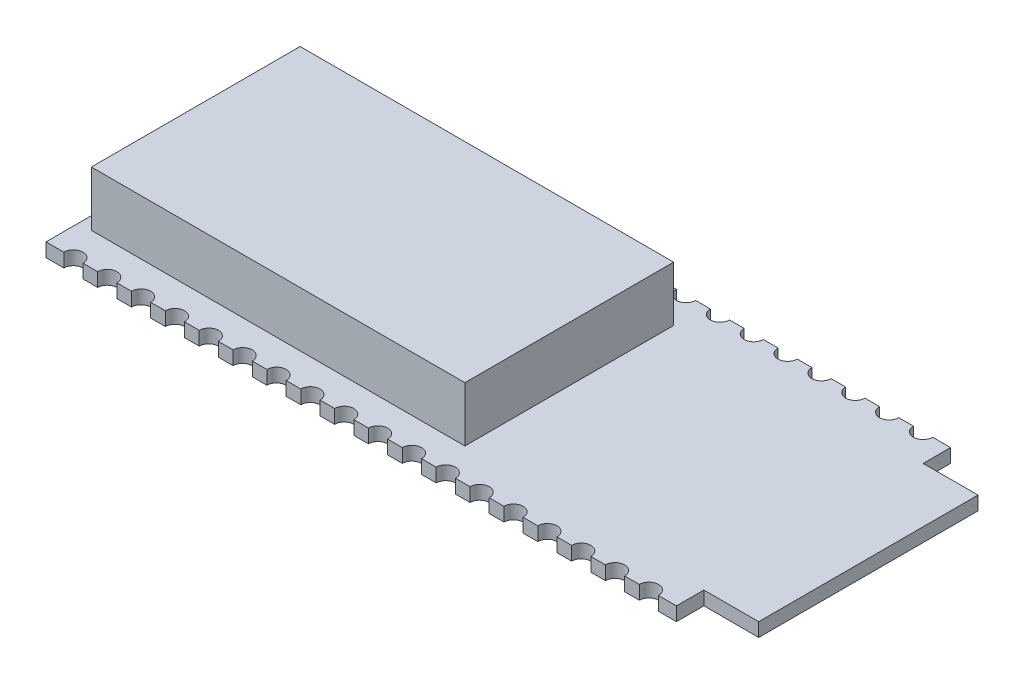
from build123d import *

# Parameters (mm, degrees)
BOSS_EXTRUDE2_DEPTH      = 1
SKETCH5_R                = 0.7
CUT_EXTRUDE2_DEPTH       = 1
LPATTERN2_COUNT          = 18
LPATTERN2_PITCH          = 2.47
MIRROR1_COPY_1_SKETCH_R  = 0.7
MIRROR1_COPY_1_DEPTH     = 1
MIRROR1_COPY_2_SKETCH_R  = 0.7
MIRROR1_COPY_2_DEPTH     = 1
MIRROR1_COPY_3_SKETCH_R  = 0.7
MIRROR1_COPY_3_DEPTH     = 1
MIRROR1_COPY_4_SKETCH_R  = 0.7
MIRROR1_COPY_4_DEPTH     = 1
MIRROR1_COPY_5_SKETCH_R  = 0.7
MIRROR1_COPY_5_DEPTH     = 1
MIRROR1_COPY_6_SKETCH_R  = 0.7
MIRROR1_COPY_6_DEPTH     = 1
MIRROR1_COPY_7_SKETCH_R  = 0.7
MIRROR1_COPY_7_DEPTH     = 1
MIRROR1_COPY_8_SKETCH_R  = 0.7
MIRROR1_COPY_8_DEPTH     = 1
MIRROR1_COPY_9_SKETCH_R  = 0.7
MIRROR1_COPY_9_DEPTH     = 1
MIRROR1_COPY_10_SKETCH_R = 0.7
MIRROR1_COPY_10_DEPTH    = 1
MIRROR1_COPY_11_SKETCH_R = 0.7
MIRROR1_COPY_11_DEPTH    = 1
MIRROR1_COPY_12_SKETCH_R = 0.7
MIRROR1_COPY_12_DEPTH    = 1
MIRROR1_COPY_13_SKETCH_R = 0.7
MIRROR1_COPY_13_DEPTH    = 1
MIRROR1_COPY_14_SKETCH_R = 0.7
MIRROR1_COPY_14_DEPTH    = 1
MIRROR1_COPY_15_SKETCH_R = 0.7
MIRROR1_COPY_15_DEPTH    = 1
MIRROR1_COPY_16_SKETCH_R = 0.7
MIRROR1_COPY_16_DEPTH    = 1
MIRROR1_COPY_17_SKETCH_R = 0.7
MIRROR1_COPY_17_DEPTH    = 1
SKETCH6_W                = 27.254379167
SKETCH6_H                = 15.23216969
BOSS_EXTRUDE3_DEPTH      = 4


with BuildPart() as part:
    # Sketch4 → Boss-Extrude2 (new body)
    with BuildSketch(Plane(origin=(0, 0, 0), x_dir=(1, 0, 0), z_dir=(0, 1, 0))):
        Polygon((-23, -10), (23, -10), (23, -8), (27, -8), (27, 8), (23, 8), (23, 10), (-23, 10), align=None)
    extrude(amount=BOSS_EXTRUDE2_DEPTH)

    # Sketch5 → Cut-Extrude2 (cut)
    with BuildSketch(Plane(origin=(0, 1, 0), x_dir=(1, 0, 0), z_dir=(0, 1, 0))):
        with Locations((-21, 10)):
            Circle(SKETCH5_R)
    cut_extrude2 = extrude(amount=-CUT_EXTRUDE2_DEPTH, mode=Mode.SUBTRACT)

    # LPattern2: Cut-Extrude2 ×18
    with Locations(*[(i * LPATTERN2_PITCH, 0, 0) for i in range(1, LPATTERN2_COUNT)]):
        add(cut_extrude2, mode=Mode.SUBTRACT)

    # Mirror1: Cut-Extrude2 across plane
    add(cut_extrude2.mirror(Plane.XY), mode=Mode.SUBTRACT)

    # Mirror1 copy 1 sketch → Mirror1 copy 1 (cut)
    with BuildSketch(Plane(origin=(2.47, 1, 0), x_dir=(1, 0, 0), z_dir=(0, 1, 0))):
        with Locations((-21, -10)):
            Circle(MIRROR1_COPY_1_SKETCH_R)
    extrude(amount=-MIRROR1_COPY_1_DEPTH, mode=Mode.SUBTRACT)

    # Mirror1 copy 2 sketch → Mirror1 copy 2 (cut)
    with BuildSketch(Plane(origin=(4.94, 1, 0), x_dir=(1, 0, 0), z_dir=(0, 1, 0))):
        with Locations((-21, -10)):
            Circle(MIRROR1_COPY_2_SKETCH_R)
    extrude(amount=-MIRROR1_COPY_2_DEPTH, mode=Mode.SUBTRACT)

    # Mirror1 copy 3 sketch → Mirror1 copy 3 (cut)
    with BuildSketch(Plane(origin=(7.41, 1, 0), x_dir=(1, 0, 0), z_dir=(0, 1, 0))):
        with Locations((-21, -10)):
            Circle(MIRROR1_COPY_3_SKETCH_R)
    extrude(amount=-MIRROR1_COPY_3_DEPTH, mode=Mode.SUBTRACT)

    # Mirror1 copy 4 sketch → Mirror1 copy 4 (cut)
    with BuildSketch(Plane(origin=(9.88, 1, 0), x_dir=(1, 0, 0), z_dir=(0, 1, 0))):
        with Locations((-21, -10)):
            Circle(MIRROR1_COPY_4_SKETCH_R)
    extrude(amount=-MIRROR1_COPY_4_DEPTH, mode=Mode.SUBTRACT)

    # Mirror1 copy 5 sketch → Mirror1 copy 5 (cut)
    with BuildSketch(Plane(origin=(12.35, 1, 0), x_dir=(1, 0, 0), z_dir=(0, 1, 0))):
        with Locations((-21, -10)):
            Circle(MIRROR1_COPY_5_SKETCH_R)
    extrude(amount=-MIRROR1_COPY_5_DEPTH, mode=Mode.SUBTRACT)

    # Mirror1 copy 6 sketch → Mirror1 copy 6 (cut)
    with BuildSketch(Plane(origin=(14.82, 1, 0), x_dir=(1, 0, 0), z_dir=(0, 1, 0))):
        with Locations((-21, -10)):
            Circle(MIRROR1_COPY_6_SKETCH_R)
    extrude(amount=-MIRROR1_COPY_6_DEPTH, mode=Mode.SUBTRACT)

    # Mirror1 copy 7 sketch → Mirror1 copy 7 (cut)
    with BuildSketch(Plane(origin=(17.29, 1, 0), x_dir=(1, 0, 0), z_dir=(0, 1, 0))):
        with Locations((-21, -10)):
            Circle(MIRROR1_COPY_7_SKETCH_R)
    extrude(amount=-MIRROR1_COPY_7_DEPTH, mode=Mode.SUBTRACT)

    # Mirror1 copy 8 sketch → Mirror1 copy 8 (cut)
    with BuildSketch(Plane(origin=(19.76, 1, 0), x_dir=(1, 0, 0), z_dir=(0, 1, 0))):
        with Locations((-21, -10)):
            Circle(MIRROR1_COPY_8_SKETCH_R)
    extrude(amount=-MIRROR1_COPY_8_DEPTH, mode=Mode.SUBTRACT)

    # Mirror1 copy 9 sketch → Mirror1 copy 9 (cut)
    with BuildSketch(Plane(origin=(22.23, 1, 0), x_dir=(1, 0, 0), z_dir=(0, 1, 0))):
        with Locations((-21, -10)):
            Circle(MIRROR1_COPY_9_SKETCH_R)
    extrude(amount=-MIRROR1_COPY_9_DEPTH, mode=Mode.SUBTRACT)

    # Mirror1 copy 10 sketch → Mirror1 copy 10 (cut)
    with BuildSketch(Plane(origin=(24.7, 1, 0), x_dir=(1, 0, 0), z_dir=(0, 1, 0))):
        with Locations((-21, -10)):
            Circle(MIRROR1_COPY_10_SKETCH_R)
    extrude(amount=-MIRROR1_COPY_10_DEPTH, mode=Mode.SUBTRACT)

    # Mirror1 copy 11 sketch → Mirror1 copy 11 (cut)
    with BuildSketch(Plane(origin=(27.17, 1, 0), x_dir=(1, 0, 0), z_dir=(0, 1, 0))):
        with Locations((-21, -10)):
            Circle(MIRROR1_COPY_11_SKETCH_R)
    extrude(amount=-MIRROR1_COPY_11_DEPTH, mode=Mode.SUBTRACT)

    # Mirror1 copy 12 sketch → Mirror1 copy 12 (cut)
    with BuildSketch(Plane(origin=(29.64, 1, 0), x_dir=(1, 0, 0), z_dir=(0, 1, 0))):
        with Locations((-21, -10)):
            Circle(MIRROR1_COPY_12_SKETCH_R)
    extrude(amount=-MIRROR1_COPY_12_DEPTH, mode=Mode.SUBTRACT)

    # Mirror1 copy 13 sketch → Mirror1 copy 13 (cut)
    with BuildSketch(Plane(origin=(32.11, 1, 0), x_dir=(1, 0, 0), z_dir=(0, 1, 0))):
        with Locations((-21, -10)):
            Circle(MIRROR1_COPY_13_SKETCH_R)
    extrude(amount=-MIRROR1_COPY_13_DEPTH, mode=Mode.SUBTRACT)

    # Mirror1 copy 14 sketch → Mirror1 copy 14 (cut)
    with BuildSketch(Plane(origin=(34.58, 1, 0), x_dir=(1, 0, 0), z_dir=(0, 1, 0))):
        with Locations((-21, -10)):
            Circle(MIRROR1_COPY_14_SKETCH_R)
    extrude(amount=-MIRROR1_COPY_14_DEPTH, mode=Mode.SUBTRACT)

    # Mirror1 copy 15 sketch → Mirror1 copy 15 (cut)
    with BuildSketch(Plane(origin=(37.05, 1, 0), x_dir=(1, 0, 0), z_dir=(0, 1, 0))):
        with Locations((-21, -10)):
            Circle(MIRROR1_COPY_15_SKETCH_R)
    extrude(amount=-MIRROR1_COPY_15_DEPTH, mode=Mode.SUBTRACT)

    # Mirror1 copy 16 sketch → Mirror1 copy 16 (cut)
    with BuildSketch(Plane(origin=(39.52, 1, 0), x_dir=(1, 0, 0), z_dir=(0, 1, 0))):
        with Locations((-21, -10)):
            Circle(MIRROR1_COPY_16_SKETCH_R)
    extrude(amount=-MIRROR1_COPY_16_DEPTH, mode=Mode.SUBTRACT)

    # Mirror1 copy 17 sketch → Mirror1 copy 17 (cut)
    with BuildSketch(Plane(origin=(41.99, 1, 0), x_dir=(1, 0, 0), z_dir=(0, 1, 0))):
        with Locations((-21, -10)):
            Circle(MIRROR1_COPY_17_SKETCH_R)
    extrude(amount=-MIRROR1_COPY_17_DEPTH, mode=Mode.SUBTRACT)

    # Sketch6 → Boss-Extrude3 (add)
    with BuildSketch(Plane(origin=(0, 1, 0), x_dir=(1, 0, 0), z_dir=(0, 1, 0))):
        with Locations((-8.447512014, 0)):
            Rectangle(SKETCH6_W, SKETCH6_H)
    extrude(amount=BOSS_EXTRUDE3_DEPTH)


solid = part.part
